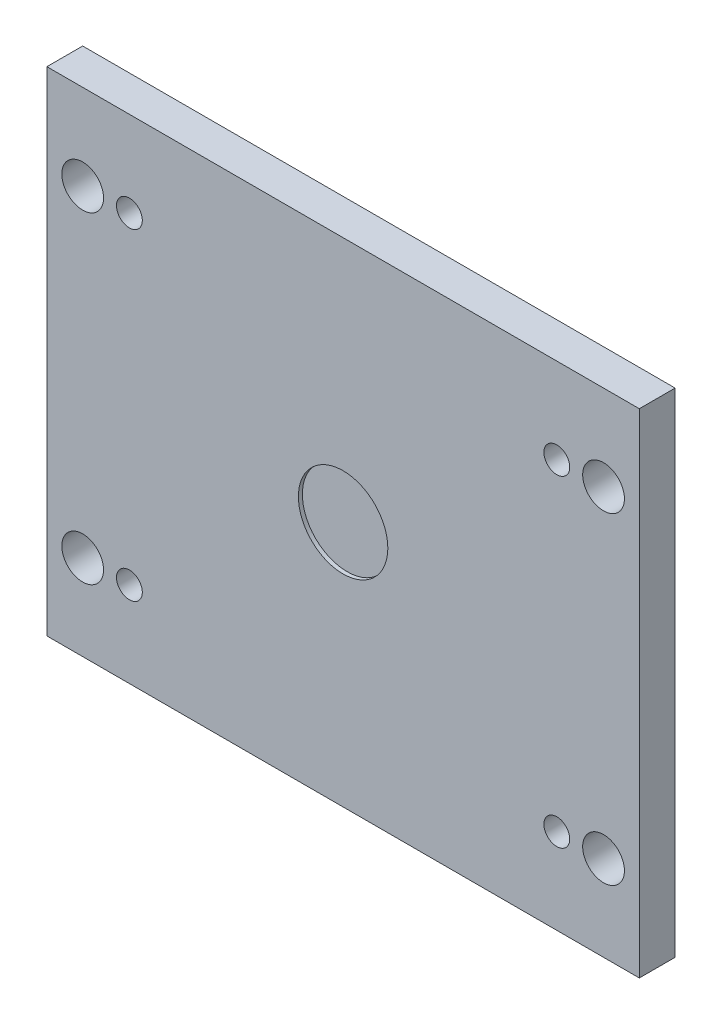
from build123d import *

# Parameters (mm, degrees)
SZKIC1_W                    = 596
SZKIC1_H                    = 496
DODANIE_WYCI_GNI_CIE1_DEPTH = 36
SZKIC2_R                    = 45
WYTNIJ_WYCI_GNI_CIE1_DEPTH  = 4
SZKIC3_R                    = 21
WYTNIJ_WYCI_GNI_CIE2_DEPTH  = 36
SZKIC4_R                    = 21
WYTNIJ_WYCI_GNI_CIE3_DEPTH  = 36
SZKIC5_R                    = 21
WYTNIJ_WYCI_GNI_CIE4_DEPTH  = 36
SZKIC6_R                    = 21
WYTNIJ_WYCI_GNI_CIE5_DEPTH  = 36
SZKIC7_W                    = 15
SZKIC7_H                    = 9
SZKIC8_W                    = 15
SZKIC8_H                    = 9
SZKIC9_W                    = 15
SZKIC9_H                    = 9
SZKIC10_W                   = 15
SZKIC10_H                   = 9
SZKIC11_W                   = 21
SZKIC11_H                   = 13
SZKIC12_W                   = 21
SZKIC12_H                   = 13
SZKIC13_W                   = 21
SZKIC13_H                   = 13
SZKIC14_W                   = 21
SZKIC14_H                   = 13


with BuildPart() as part:
    # Szkic1 → Dodanie-wyciągnięcie1 (new body)
    with BuildSketch(Plane.XY):
        Rectangle(SZKIC1_W, SZKIC1_H)
    extrude(amount=DODANIE_WYCI_GNI_CIE1_DEPTH)

    # Szkic2 → Wytnij-wyciągnięcie1 (cut)
    with BuildSketch(Plane.XY.offset(36)):
        Circle(SZKIC2_R)
    extrude(amount=-WYTNIJ_WYCI_GNI_CIE1_DEPTH, mode=Mode.SUBTRACT)

    # Szkic3 → Wytnij-wyciągnięcie2 (cut)
    with BuildSketch(Plane.XY.offset(36)):
        with Locations((262, 162)):
            Circle(SZKIC3_R)
    extrude(amount=-WYTNIJ_WYCI_GNI_CIE2_DEPTH, mode=Mode.SUBTRACT)

    # Szkic4 → Wytnij-wyciągnięcie3 (cut)
    with BuildSketch(Plane.XY.offset(36)):
        with Locations((262, -162)):
            Circle(SZKIC4_R)
    extrude(amount=-WYTNIJ_WYCI_GNI_CIE3_DEPTH, mode=Mode.SUBTRACT)

    # Szkic5 → Wytnij-wyciągnięcie4 (cut)
    with BuildSketch(Plane.XY.offset(36)):
        with Locations((-262, -162)):
            Circle(SZKIC5_R)
    extrude(amount=-WYTNIJ_WYCI_GNI_CIE4_DEPTH, mode=Mode.SUBTRACT)

    # Szkic6 → Wytnij-wyciągnięcie5 (cut)
    with BuildSketch(Plane.XY.offset(36)):
        with Locations((-262, 162)):
            Circle(SZKIC6_R)
    extrude(amount=-WYTNIJ_WYCI_GNI_CIE5_DEPTH, mode=Mode.SUBTRACT)

    # Szkic7 → Wycięcie-obrót1 (revolve, cut)
    with BuildSketch(Plane(origin=(215, 0, 0), x_dir=(0, 0, -1), z_dir=(1, 0, 0))):
        with Locations((-7.5, 166.5)):
            Rectangle(SZKIC7_W, SZKIC7_H)
    revolve(axis=Axis((215, 162, 0), (0, 0, 1)), mode=Mode.SUBTRACT)

    # Szkic8 → Wycięcie-obrót2 (revolve, cut)
    with BuildSketch(Plane(origin=(215, 0, 0), x_dir=(0, 0, -1), z_dir=(1, 0, 0))):
        with Locations((-7.5, -166.5)):
            Rectangle(SZKIC8_W, SZKIC8_H)
    revolve(axis=Axis((215, -162, 15), (0, 0, -1)), mode=Mode.SUBTRACT)

    # Szkic9 → Wycięcie-obrót3 (revolve, cut)
    with BuildSketch(Plane(origin=(-215, 0, 0), x_dir=(0, 0, -1), z_dir=(1, 0, 0))):
        with Locations((-7.5, 166.5)):
            Rectangle(SZKIC9_W, SZKIC9_H)
    revolve(axis=Axis((-215, 162, 0), (0, 0, 1)), mode=Mode.SUBTRACT)

    # Szkic10 → Wycięcie-obrót4 (revolve, cut)
    with BuildSketch(Plane(origin=(-215, 0, 0), x_dir=(0, 0, -1), z_dir=(1, 0, 0))):
        with Locations((-7.5, -166.5)):
            Rectangle(SZKIC10_W, SZKIC10_H)
    revolve(axis=Axis((-215, -162, 15), (0, 0, -1)), mode=Mode.SUBTRACT)

    # Szkic11 → Wycięcie-obrót5 (revolve, cut)
    with BuildSketch(Plane(origin=(215, 0, 0), x_dir=(0, 0, -1), z_dir=(1, 0, 0))):
        with Locations((-25.5, 168.5)):
            Rectangle(SZKIC11_W, SZKIC11_H)
    revolve(axis=Axis((215, 162, 15), (0, 0, 1)), mode=Mode.SUBTRACT)

    # Szkic12 → Wycięcie-obrót6 (revolve, cut)
    with BuildSketch(Plane(origin=(215, 0, 0), x_dir=(0, 0, -1), z_dir=(1, 0, 0))):
        with Locations((-25.5, -168.5)):
            Rectangle(SZKIC12_W, SZKIC12_H)
    revolve(axis=Axis((215, -162, 36), (0, 0, -1)), mode=Mode.SUBTRACT)

    # Szkic13 → Wycięcie-obrót7 (revolve, cut)
    with BuildSketch(Plane(origin=(-215, 0, 0), x_dir=(0, 0, -1), z_dir=(1, 0, 0))):
        with Locations((-25.5, -168.5)):
            Rectangle(SZKIC13_W, SZKIC13_H)
    revolve(axis=Axis((-215, -162, 36), (0, 0, -1)), mode=Mode.SUBTRACT)

    # Szkic14 → Wycięcie-obrót8 (revolve, cut)
    with BuildSketch(Plane(origin=(-215, 0, 0), x_dir=(0, 0, -1), z_dir=(1, 0, 0))):
        with Locations((-25.5, 168.5)):
            Rectangle(SZKIC14_W, SZKIC14_H)
    revolve(axis=Axis((-215, 162, 15), (0, 0, 1)), mode=Mode.SUBTRACT)


solid = part.part
